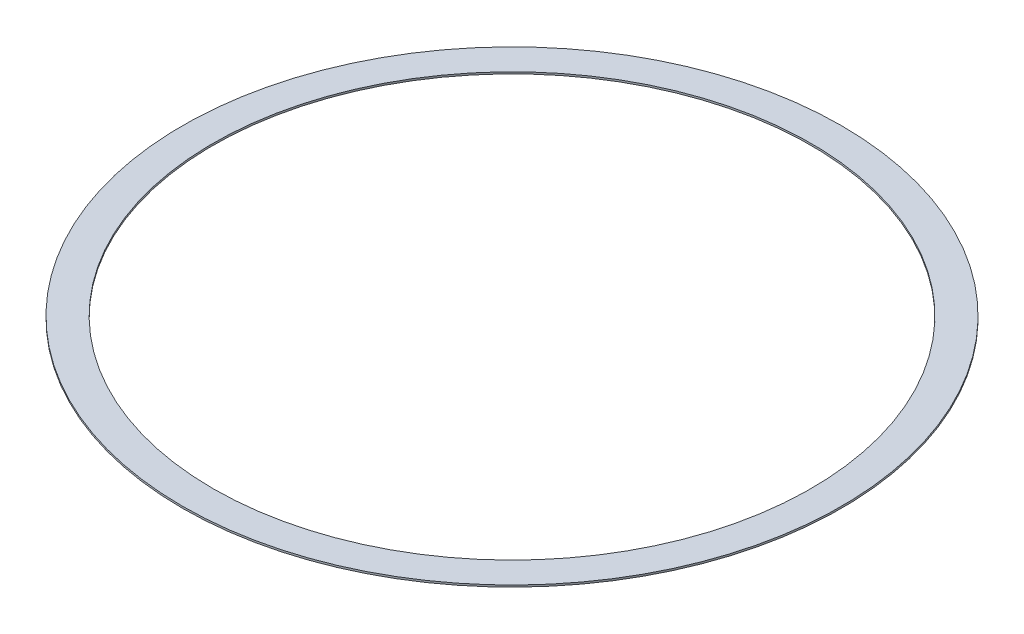
from build123d import *

# Parameters (mm, degrees)
SKETCH1_R           = 540
SKETCH1_R_2         = 490
BOSS_EXTRUDE1_DEPTH = 3


with BuildPart() as part:
    # Sketch1 → Boss-Extrude1 (new body)
    with BuildSketch(Plane(origin=(0, 0, 0), x_dir=(1, 0, 0), z_dir=(0, 1, 0))):
        with Locations(Location((0, 0, 0), (0, 0, 270))):
            Circle(SKETCH1_R)
        with Locations(Location((0, 0, 0), (0, 0, 270))):
            Circle(SKETCH1_R_2, mode=Mode.SUBTRACT)
    extrude(amount=BOSS_EXTRUDE1_DEPTH)


solid = part.part
